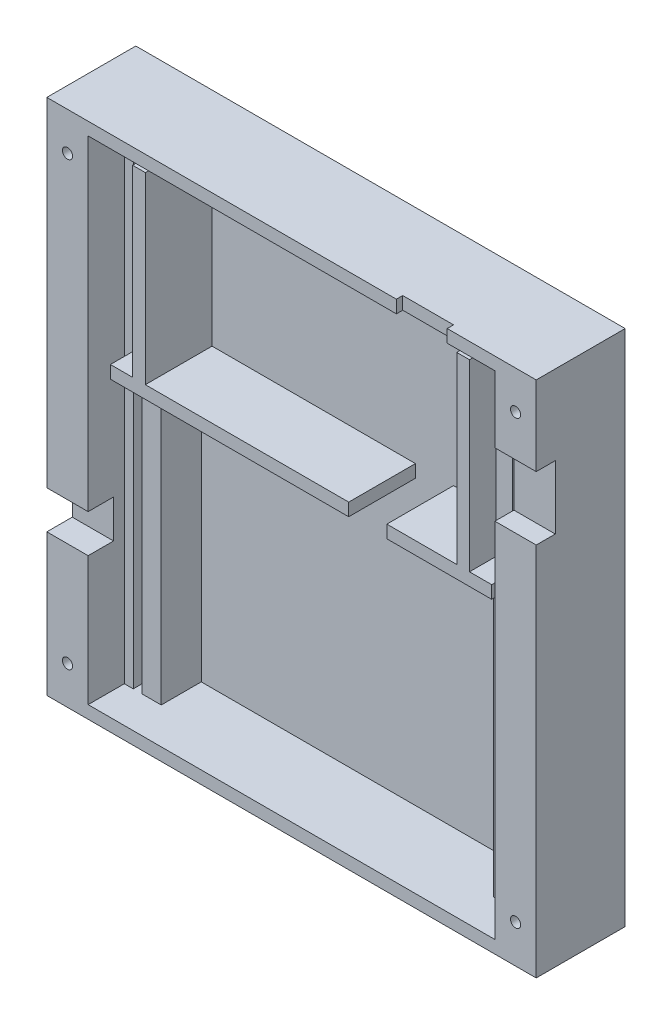
from build123d import *

# Parameters (mm, degrees)
SKETCH1_W            = 81.5
SKETCH1_H            = 77
BOSS_EXTRUDE1_DEPTH  = 2
SKETCH2_W            = 81.5
SKETCH2_H            = 6.5
BOSS_EXTRUDE2_DEPTH  = 10
SKETCH3_W            = 22.3
SKETCH3_H            = 6.5
BOSS_EXTRUDE3_DEPTH  = 14
SKETCH4_W            = 53.2
SKETCH4_H            = 6.5
BOSS_EXTRUDE4_DEPTH  = 14
SKETCH5_W            = 81.5
SKETCH5_H            = 6.5
BOSS_EXTRUDE5_DEPTH  = 11
SKETCH6_W            = 59
SKETCH6_H            = 6.5
BOSS_EXTRUDE6_DEPTH  = 14
SKETCH7_W            = 12.5
SKETCH7_H            = 6.5
BOSS_EXTRUDE7_DEPTH  = 14
SKETCH8_W            = 2
SKETCH8_H            = 64
BOSS_EXTRUDE8_DEPTH  = 14
SKETCH9_W            = 2
SKETCH9_H            = 64
BOSS_EXTRUDE9_DEPTH  = 13
SKETCH10_W           = 2
SKETCH10_H           = 48.5
BOSS_EXTRUDE10_DEPTH = 14
SKETCH11_W           = 2
SKETCH11_H           = 7.5
BOSS_EXTRUDE11_DEPTH = 14
SKETCH12_W           = 77.5
SKETCH12_H           = 1.4
BOSS_EXTRUDE12_DEPTH = 8.3
SKETCH13_W           = 77.5
SKETCH13_H           = 3
BOSS_EXTRUDE13_DEPTH = 8.3
SKETCH14_W           = 77.5
SKETCH14_H           = 3
BOSS_EXTRUDE14_DEPTH = 8.3
SKETCH15_W           = 77.5
SKETCH15_H           = 1.5
BOSS_EXTRUDE15_DEPTH = 8.3
SKETCH16_W           = 2
SKETCH16_H           = 37.5
BOSS_EXTRUDE16_DEPTH = 12.5
SKETCH17_W           = 2
SKETCH17_H           = 16.5
BOSS_EXTRUDE17_DEPTH = 12.5
SKETCH18_W           = 28.9
SKETCH18_H           = 2
BOSS_EXTRUDE18_DEPTH = 12.5
SKETCH19_W           = 28.9
SKETCH19_H           = 2
BOSS_EXTRUDE19_DEPTH = 12.5
SKETCH20_R           = 0.8
CUT_EXTRUDE1_DEPTH   = 20
SKETCH21_R           = 0.8
CUT_EXTRUDE2_DEPTH   = 20
SKETCH22_R           = 0.8
CUT_EXTRUDE3_DEPTH   = 20
SKETCH23_R           = 0.8
CUT_EXTRUDE4_DEPTH   = 20


with BuildPart() as part:
    # Sketch1 → Boss-Extrude1 (new body)
    with BuildSketch(Plane(origin=(0, 0, 0), x_dir=(0, 1, 0), z_dir=(0, 0, 1))):
        with Locations((40.75, -38.5)):
            Rectangle(SKETCH1_W, SKETCH1_H)
    extrude(amount=BOSS_EXTRUDE1_DEPTH)

    # Sketch2 → Boss-Extrude2 (add)
    with BuildSketch(Plane(origin=(0, 0, 0), x_dir=(0, 1, 0), z_dir=(0, 0, 1))):
        with Locations((40.75, -3.25)):
            Rectangle(SKETCH2_W, SKETCH2_H)
    extrude(amount=BOSS_EXTRUDE2_DEPTH)

    # Sketch3 → Boss-Extrude3 (add)
    with BuildSketch(Plane(origin=(0, 0, 0), x_dir=(0, 1, 0), z_dir=(0, 0, 1))):
        with Locations((11.15, -3.25)):
            Rectangle(SKETCH3_W, SKETCH3_H)
    extrude(amount=BOSS_EXTRUDE3_DEPTH)

    # Sketch4 → Boss-Extrude4 (add)
    with BuildSketch(Plane(origin=(0, 0, 0), x_dir=(0, 1, 0), z_dir=(0, 0, 1))):
        with Locations((54.9, -3.25)):
            Rectangle(SKETCH4_W, SKETCH4_H)
    extrude(amount=BOSS_EXTRUDE4_DEPTH)

    # Sketch5 → Boss-Extrude5 (add)
    with BuildSketch(Plane(origin=(0, 0, 0), x_dir=(0, 1, 0), z_dir=(0, 0, 1))):
        with Locations((40.75, -73.75)):
            Rectangle(SKETCH5_W, SKETCH5_H)
    extrude(amount=BOSS_EXTRUDE5_DEPTH)

    # Sketch6 → Boss-Extrude6 (add)
    with BuildSketch(Plane(origin=(0, 0, 0), x_dir=(0, 1, 0), z_dir=(0, 0, 1))):
        with Locations((29.5, -73.75)):
            Rectangle(SKETCH6_W, SKETCH6_H)
    extrude(amount=BOSS_EXTRUDE6_DEPTH)

    # Sketch7 → Boss-Extrude7 (add)
    with BuildSketch(Plane(origin=(0, 0, 0), x_dir=(0, 1, 0), z_dir=(0, 0, 1))):
        with Locations((75.25, -73.75)):
            Rectangle(SKETCH7_W, SKETCH7_H)
    extrude(amount=BOSS_EXTRUDE7_DEPTH)

    # Sketch8 → Boss-Extrude8 (add)
    with BuildSketch(Plane(origin=(0, 0, 0), x_dir=(0, 1, 0), z_dir=(0, 0, 1))):
        with Locations((1, -38.5)):
            Rectangle(SKETCH8_W, SKETCH8_H)
    extrude(amount=BOSS_EXTRUDE8_DEPTH)

    # Sketch9 → Boss-Extrude9 (add)
    with BuildSketch(Plane(origin=(0, 0, 0), x_dir=(0, 1, 0), z_dir=(0, 0, 1))):
        with Locations((80.5, -38.5)):
            Rectangle(SKETCH9_W, SKETCH9_H)
    extrude(amount=BOSS_EXTRUDE9_DEPTH)

    # Sketch10 → Boss-Extrude10 (add)
    with BuildSketch(Plane(origin=(0, 0, 0), x_dir=(0, 1, 0), z_dir=(0, 0, 1))):
        with Locations((80.5, -30.75)):
            Rectangle(SKETCH10_W, SKETCH10_H)
    extrude(amount=BOSS_EXTRUDE10_DEPTH)

    # Sketch11 → Boss-Extrude11 (add)
    with BuildSketch(Plane(origin=(0, 0, 0), x_dir=(0, 1, 0), z_dir=(0, 0, 1))):
        with Locations((80.5, -66.75)):
            Rectangle(SKETCH11_W, SKETCH11_H)
    extrude(amount=BOSS_EXTRUDE11_DEPTH)

    # Sketch12 → Boss-Extrude12 (add)
    with BuildSketch(Plane(origin=(0, 0, 0), x_dir=(0, 1, 0), z_dir=(0, 0, 1))):
        with Locations((40.75, -7.2)):
            Rectangle(SKETCH12_W, SKETCH12_H)
    extrude(amount=BOSS_EXTRUDE12_DEPTH)

    # Sketch13 → Boss-Extrude13 (add)
    with BuildSketch(Plane(origin=(0, 0, 0), x_dir=(0, 1, 0), z_dir=(0, 0, 1))):
        with Locations((40.75, -10.8)):
            Rectangle(SKETCH13_W, SKETCH13_H)
    extrude(amount=BOSS_EXTRUDE13_DEPTH)

    # Sketch14 → Boss-Extrude14 (add)
    with BuildSketch(Plane(origin=(0, 0, 0), x_dir=(0, 1, 0), z_dir=(0, 0, 1))):
        with Locations((40.75, -66.1)):
            Rectangle(SKETCH14_W, SKETCH14_H)
    extrude(amount=BOSS_EXTRUDE14_DEPTH)

    # Sketch15 → Boss-Extrude15 (add)
    with BuildSketch(Plane(origin=(0, 0, 0), x_dir=(0, 1, 0), z_dir=(0, 0, 1))):
        with Locations((40.75, -69.75)):
            Rectangle(SKETCH15_W, SKETCH15_H)
    extrude(amount=BOSS_EXTRUDE15_DEPTH)

    # Sketch16 → Boss-Extrude16 (add)
    with BuildSketch(Plane(origin=(0, 0, 0), x_dir=(0, 1, 0), z_dir=(0, 0, 1))):
        with Locations((47.6, -27.25)):
            Rectangle(SKETCH16_W, SKETCH16_H)
    extrude(amount=BOSS_EXTRUDE16_DEPTH)

    # Sketch17 → Boss-Extrude17 (add)
    with BuildSketch(Plane(origin=(0, 0, 0), x_dir=(0, 1, 0), z_dir=(0, 0, 1))):
        with Locations((47.6, -60.25)):
            Rectangle(SKETCH17_W, SKETCH17_H)
    extrude(amount=BOSS_EXTRUDE17_DEPTH)

    # Sketch18 → Boss-Extrude18 (add)
    with BuildSketch(Plane(origin=(0, 0, 0), x_dir=(0, 1, 0), z_dir=(0, 0, 1))):
        with Locations((63.05, -13)):
            Rectangle(SKETCH18_W, SKETCH18_H)
    extrude(amount=BOSS_EXTRUDE18_DEPTH)

    # Sketch19 → Boss-Extrude19 (add)
    with BuildSketch(Plane(origin=(0, 0, 0), x_dir=(0, 1, 0), z_dir=(0, 0, 1))):
        with Locations((63.05, -64)):
            Rectangle(SKETCH19_W, SKETCH19_H)
    extrude(amount=BOSS_EXTRUDE19_DEPTH)

    # Sketch20 → Cut-Extrude1 (cut)
    with BuildSketch(Plane(origin=(0, 0, 0), x_dir=(0, 1, 0), z_dir=(0, 0, 1))):
        with Locations(Location((6, -3.25, 0), (0, 0, 270))):
            Circle(SKETCH20_R)
    extrude(amount=CUT_EXTRUDE1_DEPTH, mode=Mode.SUBTRACT)

    # Sketch21 → Cut-Extrude2 (cut)
    with BuildSketch(Plane(origin=(0, 0, 0), x_dir=(0, 1, 0), z_dir=(0, 0, 1))):
        with Locations(Location((75.5, -3.25, 0), (0, 0, 270))):
            Circle(SKETCH21_R)
    extrude(amount=CUT_EXTRUDE2_DEPTH, mode=Mode.SUBTRACT)

    # Sketch22 → Cut-Extrude3 (cut)
    with BuildSketch(Plane(origin=(0, 0, 0), x_dir=(0, 1, 0), z_dir=(0, 0, 1))):
        with Locations(Location((6, -73.75, 0), (0, 0, 270))):
            Circle(SKETCH22_R)
    extrude(amount=CUT_EXTRUDE3_DEPTH, mode=Mode.SUBTRACT)

    # Sketch23 → Cut-Extrude4 (cut)
    with BuildSketch(Plane(origin=(0, 0, 0), x_dir=(0, 1, 0), z_dir=(0, 0, 1))):
        with Locations(Location((75.5, -73.75, 0), (0, 0, 270))):
            Circle(SKETCH23_R)
    extrude(amount=CUT_EXTRUDE4_DEPTH, mode=Mode.SUBTRACT)


solid = part.part
